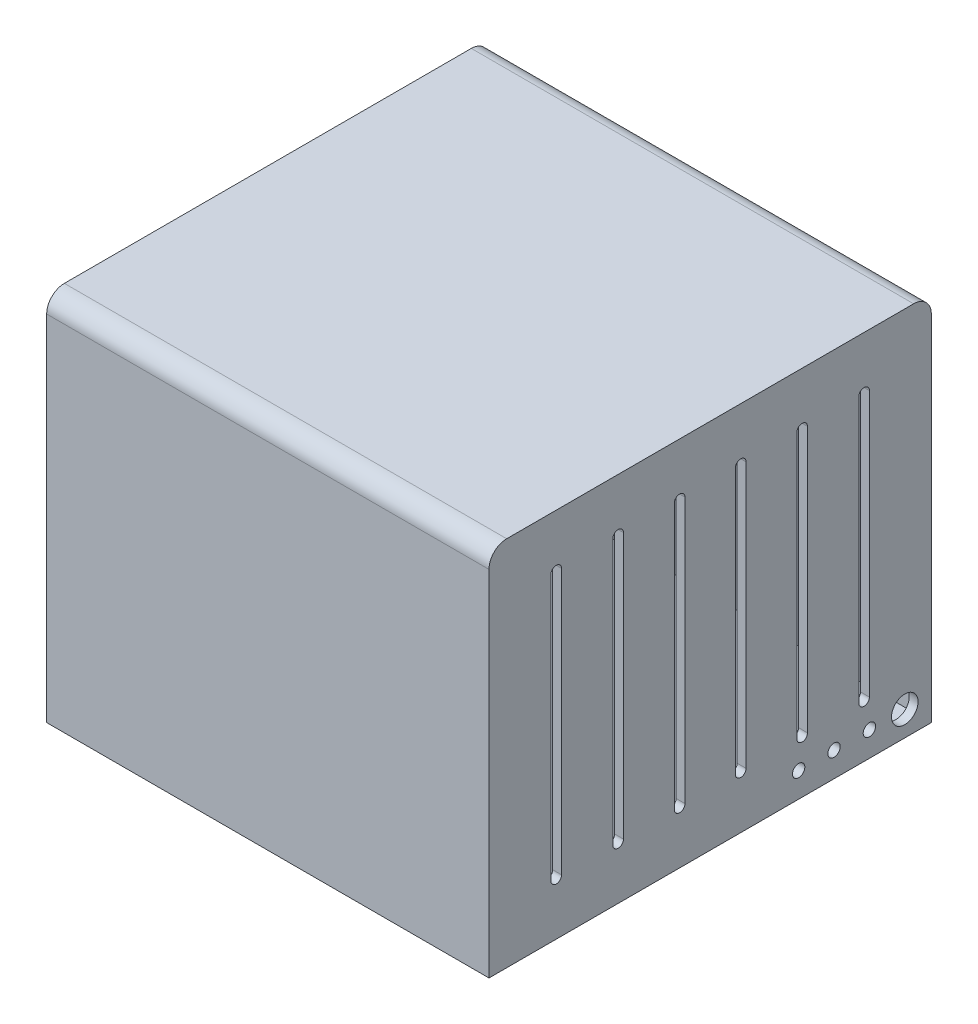
from build123d import *

# Parameters (mm, degrees)
SKETCH1_W                = 125
SKETCH1_H                = 125
BOSS_EXTRUDE1_DEPTH      = 2.5
SKETCH3_W                = 125
SKETCH3_H                = 100
BOSS_EXTRUDE3_DEPTH      = 2.5
SKETCH2_W                = 125
SKETCH2_H                = 100
BOSS_EXTRUDE4_DEPTH      = 2.5
SKETCH5_W                = 125
SKETCH5_H                = 102.5
BOSS_EXTRUDE6_DEPTH      = 2.5
SKETCH11_W               = 8
SKETCH11_H               = 1.5
BOSS_EXTRUDE9_DEPTH      = 3
SKETCH12_W               = 8
SKETCH12_H               = 1.5
BOSS_EXTRUDE10_DEPTH     = 4.5
MIRROR10_COPY_1_SKETCH_W = 8
MIRROR10_COPY_1_SKETCH_H = 1.5
MIRROR10_COPY_1_DEPTH    = 3
MIRROR10_COPY_2_SKETCH_W = 8
MIRROR10_COPY_2_SKETCH_H = 1.5
MIRROR10_COPY_2_DEPTH    = 3
MIRROR11_COPY_1_SKETCH_W = 8
MIRROR11_COPY_1_SKETCH_H = 1.5
MIRROR11_COPY_1_DEPTH    = 4.5
MIRROR11_COPY_2_SKETCH_W = 8
MIRROR11_COPY_2_SKETCH_H = 1.5
MIRROR11_COPY_2_DEPTH    = 4.5
SKETCH13_W               = 3
SKETCH13_H               = 75
CUT_EXTRUDE3_DEPTH       = 4.5
SKETCH15_W               = 3
SKETCH15_H               = 75
CUT_EXTRUDE4_DEPTH       = 4.5
SKETCH17_W               = 3
SKETCH17_H               = 75
CUT_EXTRUDE5_DEPTH       = 4.5
SKETCH18_R               = 1.5
CUT_EXTRUDE6_DEPTH       = 4.5
SKETCH19_R               = 1.5
CUT_EXTRUDE7_DEPTH       = 4.5
SKETCH21_R               = 1.5
CUT_EXTRUDE8_DEPTH       = 4.5
SKETCH20_R               = 1.5
CUT_EXTRUDE9_DEPTH       = 4.5
SKETCH22_R               = 1.5
CUT_EXTRUDE10_DEPTH      = 4.5
SKETCH23_R               = 1.5
CUT_EXTRUDE11_DEPTH      = 4.5
SKETCH24_W               = 125
SKETCH24_H               = 125
BOSS_EXTRUDE11_DEPTH     = 2.5
SKETCH25_W               = 10
SKETCH25_H               = 10
BOSS_EXTRUDE12_DEPTH     = 2.5
SKETCH26_W               = 10
SKETCH26_H               = 10
BOSS_EXTRUDE13_DEPTH     = 2.5
SKETCH27_R               = 1.5
CUT_EXTRUDE12_DEPTH      = 2.5
SKETCH28_R               = 1.5
CUT_EXTRUDE13_DEPTH      = 2.5
SKETCH31_R               = 1.75
CUT_EXTRUDE14_DEPTH      = 10
SKETCH29_R               = 1.75
CUT_EXTRUDE15_DEPTH      = 10
SKETCH32_R               = 1.75
CUT_EXTRUDE16_DEPTH      = 10
FILLET1_R                = 5
FILLET2_R                = 5
SKETCH33_R               = 3.75
CUT_EXTRUDE17_DEPTH      = 10


with BuildPart() as part:
    # Sketch1 → Boss-Extrude1 (new body)
    with BuildSketch(Plane(origin=(0, 0, 0), x_dir=(1, 0, 0), z_dir=(0, 1, 0))):
        Rectangle(SKETCH1_W, SKETCH1_H)
    extrude(amount=BOSS_EXTRUDE1_DEPTH)

    # Sketch3 → Boss-Extrude3 (add)
    with BuildSketch(Plane(origin=(0, 0, -62.5), x_dir=(-1, 0, 0), z_dir=(0, 0, -1))):
        with Locations((0, 52.5)):
            Rectangle(SKETCH3_W, SKETCH3_H)
    extrude(amount=-BOSS_EXTRUDE3_DEPTH)

    # Sketch2 → Boss-Extrude4 (add)
    with BuildSketch(Plane.XY.offset(62.5)):
        with Locations((0, 52.5)):
            Rectangle(SKETCH2_W, SKETCH2_H)
    extrude(amount=-BOSS_EXTRUDE4_DEPTH)

    # Sketch5 → Boss-Extrude6 (add)
    with BuildSketch(Plane(origin=(62.5, 0, 0), x_dir=(0, 0, -1), z_dir=(1, 0, 0))):
        with Locations((0, 51.25)):
            Rectangle(SKETCH5_W, SKETCH5_H)
    extrude(amount=-BOSS_EXTRUDE6_DEPTH)

    # Sketch11 → Boss-Extrude9 (add)
    with BuildSketch(Plane(origin=(0, 2.5, 0), x_dir=(1, 0, 0), z_dir=(0, 1, 0))):
        with Locations((54, 50.75)):
            Rectangle(SKETCH11_W, SKETCH11_H)
    boss_extrude9 = extrude(amount=BOSS_EXTRUDE9_DEPTH)

    # Mirror6: Boss-Extrude9 across plane
    add(boss_extrude9.mirror(Plane.XY))

    # Sketch12 → Boss-Extrude10 (add)
    with BuildSketch(Plane.XY.offset(-50)):
        with Locations((54, 4.75)):
            Rectangle(SKETCH12_W, SKETCH12_H)
    boss_extrude10 = extrude(amount=BOSS_EXTRUDE10_DEPTH)

    # Mirror7: Boss-Extrude10 across plane
    add(boss_extrude10.mirror(Plane.XY))

    # Mirror8: Boss-Extrude9 across plane
    add(boss_extrude9.mirror(Plane(origin=(0, 0, 0), x_dir=(0, 0, 1), z_dir=(1, 0, 0))))

    # Mirror9: Boss-Extrude10 across plane
    add(boss_extrude10.mirror(Plane(origin=(0, 0, 0), x_dir=(0, 0, 1), z_dir=(1, 0, 0))))

    # Mirror10 copy 1 sketch → Mirror10 copy 1 (add)
    with BuildSketch(Plane(origin=(0, 2.5, 0), x_dir=(-1, 0, 0), z_dir=(0, 1, 0))):
        with Locations((54, 50.75)):
            Rectangle(MIRROR10_COPY_1_SKETCH_W, MIRROR10_COPY_1_SKETCH_H)
    extrude(amount=MIRROR10_COPY_1_DEPTH)

    # Mirror10 copy 2 sketch → Mirror10 copy 2 (add)
    with BuildSketch(Plane(origin=(0, 2.5, 0), x_dir=(1, 0, 0), z_dir=(0, 1, 0))):
        with Locations((54, -50.75)):
            Rectangle(MIRROR10_COPY_2_SKETCH_W, MIRROR10_COPY_2_SKETCH_H)
    extrude(amount=MIRROR10_COPY_2_DEPTH)

    # Mirror11 copy 1 sketch → Mirror11 copy 1 (add)
    with BuildSketch(Plane(origin=(0, 0, 50), x_dir=(-1, 0, 0), z_dir=(0, 0, -1))):
        with Locations((54, 4.75)):
            Rectangle(MIRROR11_COPY_1_SKETCH_W, MIRROR11_COPY_1_SKETCH_H)
    extrude(amount=MIRROR11_COPY_1_DEPTH)

    # Mirror11 copy 2 sketch → Mirror11 copy 2 (add)
    with BuildSketch(Plane(origin=(0, 0, 50), x_dir=(1, 0, 0), z_dir=(0, 0, -1))):
        with Locations((54, -4.75)):
            Rectangle(MIRROR11_COPY_2_SKETCH_W, MIRROR11_COPY_2_SKETCH_H)
    extrude(amount=MIRROR11_COPY_2_DEPTH)

    # Sketch13 → Cut-Extrude3 (cut)
    with BuildSketch(Plane(origin=(62.5, 0, -52.868964846), x_dir=(0, 0, -1), z_dir=(1, 0, 0))):
        with Locations((-61.5, 52.5)):
            Rectangle(SKETCH13_W, SKETCH13_H)
    cut_extrude3 = extrude(amount=-CUT_EXTRUDE3_DEPTH, mode=Mode.SUBTRACT)

    # Sketch15 → Cut-Extrude4 (cut)
    with BuildSketch(Plane(origin=(62.5, 0, 0), x_dir=(0, 0, -1), z_dir=(1, 0, 0))):
        with Locations((-43.5, 52.5)):
            Rectangle(SKETCH15_W, SKETCH15_H)
    cut_extrude4 = extrude(amount=-CUT_EXTRUDE4_DEPTH, mode=Mode.SUBTRACT)

    # Sketch17 → Cut-Extrude5 (cut)
    with BuildSketch(Plane(origin=(62.5, 0, 0), x_dir=(0, 0, -1), z_dir=(1, 0, 0))):
        with Locations((-26, 52.5)):
            Rectangle(SKETCH17_W, SKETCH17_H)
    cut_extrude5 = extrude(amount=-CUT_EXTRUDE5_DEPTH, mode=Mode.SUBTRACT)

    # Mirror12: Cut-Extrude5 across plane
    add(cut_extrude5.mirror(Plane.XY), mode=Mode.SUBTRACT)

    # Mirror13: Cut-Extrude4 across plane
    add(cut_extrude4.mirror(Plane.XY), mode=Mode.SUBTRACT)

    # Mirror14: Cut-Extrude3 across plane
    add(cut_extrude3.mirror(Plane.XY), mode=Mode.SUBTRACT)

    # Sketch18 → Cut-Extrude6 (cut)
    with BuildSketch(Plane(origin=(62.5, 0, 0), x_dir=(0, 0, -1), z_dir=(1, 0, 0))):
        with Locations((-8.631035154, 90)):
            Circle(SKETCH18_R)
    cut_extrude6 = extrude(amount=-CUT_EXTRUDE6_DEPTH, mode=Mode.SUBTRACT)

    # Sketch19 → Cut-Extrude7 (cut)
    with BuildSketch(Plane(origin=(62.5, 0, 0), x_dir=(0, 0, -1), z_dir=(1, 0, 0))):
        with Locations((-8.631035154, 15)):
            Circle(SKETCH19_R)
    cut_extrude7 = extrude(amount=-CUT_EXTRUDE7_DEPTH, mode=Mode.SUBTRACT)

    # Sketch21 → Cut-Extrude8 (cut)
    with BuildSketch(Plane(origin=(62.5, 0, 0), x_dir=(0, 0, -1), z_dir=(1, 0, 0))):
        with Locations((-26, 15)):
            Circle(SKETCH21_R)
    cut_extrude8 = extrude(amount=-CUT_EXTRUDE8_DEPTH, mode=Mode.SUBTRACT)

    # Sketch20 → Cut-Extrude9 (cut)
    with BuildSketch(Plane(origin=(62.5, 0, 0), x_dir=(0, 0, -1), z_dir=(1, 0, 0))):
        with Locations((-43.5, 15)):
            Circle(SKETCH20_R)
    cut_extrude9 = extrude(amount=-CUT_EXTRUDE9_DEPTH, mode=Mode.SUBTRACT)

    # Mirror15: Cut-Extrude7 across plane
    add(cut_extrude7.mirror(Plane.XY), mode=Mode.SUBTRACT)

    # Mirror16: Cut-Extrude9 across plane
    add(cut_extrude9.mirror(Plane.XY), mode=Mode.SUBTRACT)

    # Mirror17: Cut-Extrude8 across plane
    add(cut_extrude8.mirror(Plane.XY), mode=Mode.SUBTRACT)

    # Sketch22 → Cut-Extrude10 (cut)
    with BuildSketch(Plane(origin=(62.5, 0, 0), x_dir=(0, 0, -1), z_dir=(1, 0, 0))):
        with Locations((-43.5, 90)):
            Circle(SKETCH22_R)
    cut_extrude10 = extrude(amount=-CUT_EXTRUDE10_DEPTH, mode=Mode.SUBTRACT)

    # Sketch23 → Cut-Extrude11 (cut)
    with BuildSketch(Plane(origin=(62.5, 0, 0), x_dir=(0, 0, -1), z_dir=(1, 0, 0))):
        with Locations((-26, 90)):
            Circle(SKETCH23_R)
    cut_extrude11 = extrude(amount=-CUT_EXTRUDE11_DEPTH, mode=Mode.SUBTRACT)

    # Mirror18: Cut-Extrude10 across plane
    add(cut_extrude10.mirror(Plane.XY), mode=Mode.SUBTRACT)

    # Mirror19: Cut-Extrude6 across plane
    add(cut_extrude6.mirror(Plane.XY), mode=Mode.SUBTRACT)

    # Mirror20: Cut-Extrude11 across plane
    add(cut_extrude11.mirror(Plane.XY), mode=Mode.SUBTRACT)

    # Sketch24 → Boss-Extrude11 (add)
    with BuildSketch(Plane(origin=(0, 102.5, 0), x_dir=(1, 0, 0), z_dir=(0, 1, 0))):
        Rectangle(SKETCH24_W, SKETCH24_H)
    extrude(amount=BOSS_EXTRUDE11_DEPTH)

    # Sketch25 → Boss-Extrude12 (add)
    with BuildSketch(Plane.ZY.offset(62.5)):
        with Locations((-57.5, 100)):
            Rectangle(SKETCH25_W, SKETCH25_H)
    boss_extrude12 = extrude(amount=-BOSS_EXTRUDE12_DEPTH)

    # Mirror21: Boss-Extrude12 across plane
    add(boss_extrude12.mirror(Plane.XY))

    # Sketch26 → Boss-Extrude13 (add)
    with BuildSketch(Plane.ZY.offset(62.5)):
        with Locations((-57.5, 5)):
            Rectangle(SKETCH26_W, SKETCH26_H)
    boss_extrude13 = extrude(amount=-BOSS_EXTRUDE13_DEPTH)

    # Mirror22: Boss-Extrude13 across plane
    add(boss_extrude13.mirror(Plane.XY))

    # Sketch27 → Cut-Extrude12 (cut)
    with BuildSketch(Plane.ZY.offset(62.5)):
        with Locations((-56.5, 99)):
            Circle(SKETCH27_R)
    cut_extrude12 = extrude(amount=-CUT_EXTRUDE12_DEPTH, mode=Mode.SUBTRACT)

    # Mirror23: Cut-Extrude12 across plane
    add(cut_extrude12.mirror(Plane.XY), mode=Mode.SUBTRACT)

    # Sketch28 → Cut-Extrude13 (cut)
    with BuildSketch(Plane.ZY.offset(62.5)):
        with Locations((-56.5, 6)):
            Circle(SKETCH28_R)
    cut_extrude13 = extrude(amount=-CUT_EXTRUDE13_DEPTH, mode=Mode.SUBTRACT)

    # Mirror24: Cut-Extrude13 across plane
    add(cut_extrude13.mirror(Plane.XY), mode=Mode.SUBTRACT)

    # Sketch31 → Cut-Extrude14 (cut)
    with BuildSketch(Plane(origin=(62.5, 0, 0), x_dir=(0, 0, -1), z_dir=(1, 0, 0))):
        with Locations((35, 7)):
            Circle(SKETCH31_R)
    extrude(amount=-CUT_EXTRUDE14_DEPTH, mode=Mode.SUBTRACT)

    # Sketch29 → Cut-Extrude15 (cut)
    with BuildSketch(Plane(origin=(62.5, 0, 0), x_dir=(0, 0, -1), z_dir=(1, 0, 0))):
        with Locations((25, 7)):
            Circle(SKETCH29_R)
    extrude(amount=-CUT_EXTRUDE15_DEPTH, mode=Mode.SUBTRACT)

    # Sketch32 → Cut-Extrude16 (cut)
    with BuildSketch(Plane(origin=(62.5, 0, 0), x_dir=(0, 0, -1), z_dir=(1, 0, 0))):
        with Locations((45, 7)):
            Circle(SKETCH32_R)
    extrude(amount=-CUT_EXTRUDE16_DEPTH, mode=Mode.SUBTRACT)

    # Fillet1
    fillet1_edges = [part.edges().sort_by_distance(p)[0] for p in [
        (0, 105, 62.5),
    ]]
    fillet(fillet1_edges, radius=FILLET1_R)

    # Fillet2
    fillet2_edges = [part.edges().sort_by_distance(p)[0] for p in [
        (0, 105, -62.5),
    ]]
    fillet(fillet2_edges, radius=FILLET2_R)

    # Sketch33 → Cut-Extrude17 (cut)
    with BuildSketch(Plane(origin=(62.5, 0, 0), x_dir=(0, 0, -1), z_dir=(1, 0, 0))):
        with Locations((55, 7)):
            Circle(SKETCH33_R)
    extrude(amount=-CUT_EXTRUDE17_DEPTH, mode=Mode.SUBTRACT)


solid = part.part
